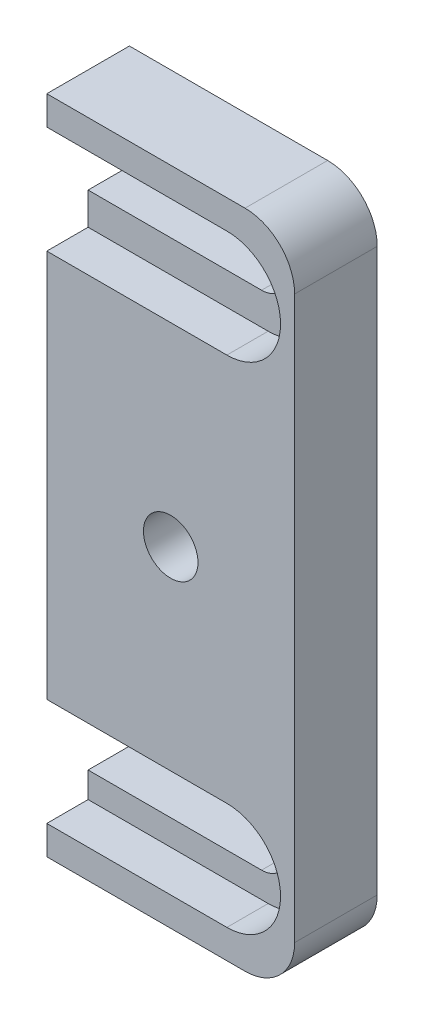
from build123d import *

# Parameters (mm, degrees)
SKETCH1_R           = 1.65
BOSS_EXTRUDE1_DEPTH = 5
CUT_EXTRUDE1_START  = -2.5
CUT_EXTRUDE1_DEPTH  = 2.5


with BuildPart() as part:
    # Sketch1 → Boss-Extrude1 (new body)
    with BuildSketch(Plane.XY):
        with BuildLine():
            Line((-7.5, 16.7), (3, 16.7))
            ThreePointArc((3, 16.7), (4.5, 15.2), (3, 13.7))
            Line((3, 13.7), (-7.5, 13.7))
            Line((-7.5, 13.7), (-7.5, -13.7))
            Line((-7.5, -13.7), (3, -13.7))
            ThreePointArc((3, -13.7), (4.5, -15.2), (3, -16.7))
            Line((3, -16.7), (-7.5, -16.7))
            Line((-7.5, -16.7), (-7.5, -20))
            Line((-7.5, -20), (4.5, -20))
            ThreePointArc((4.5, -20), (6.621320344, -19.121320344), (7.5, -17))
            Line((7.5, -17), (7.5, 17))
            ThreePointArc((7.5, 17), (6.621320344, 19.121320344), (4.5, 20))
            Line((4.5, 20), (-7.5, 20))
            Line((-7.5, 20), (-7.5, 16.7))
        make_face()
        Circle(SKETCH1_R, mode=Mode.SUBTRACT)
    extrude(amount=BOSS_EXTRUDE1_DEPTH)

    # Sketch2 → Cut-Extrude1 (cut)
    with BuildSketch(Plane.XY.offset(5).offset(CUT_EXTRUDE1_START)):
        with BuildLine():
            Line((3.4, -11.75), (-7.5, -11.75))
            Line((-7.5, -11.75), (-7.5, -13.7))
            Line((-7.5, -13.7), (3, -13.7))
            ThreePointArc((3, -13.7), (4.5, -15.2), (3, -16.7))
            Line((3, -16.7), (-7.5, -16.7))
            Line((-7.5, -16.7), (-7.5, -18.25))
            Line((-7.5, -18.25), (3.4, -18.25))
            ThreePointArc((3.4, -18.25), (6.65, -15), (3.4, -11.75))
        make_face()
        with BuildLine():
            Line((3.4, 18.25), (-7.5, 18.25))
            Line((-7.5, 18.25), (-7.5, 16.7))
            Line((-7.5, 16.7), (3, 16.7))
            ThreePointArc((3, 16.7), (4.5, 15.2), (3, 13.7))
            Line((3, 13.7), (-7.5, 13.7))
            Line((-7.5, 13.7), (-7.5, 11.75))
            Line((-7.5, 11.75), (3.4, 11.75))
            ThreePointArc((3.4, 11.75), (6.65, 15), (3.4, 18.25))
        make_face()
    extrude(amount=CUT_EXTRUDE1_DEPTH, mode=Mode.SUBTRACT)


solid = part.part
